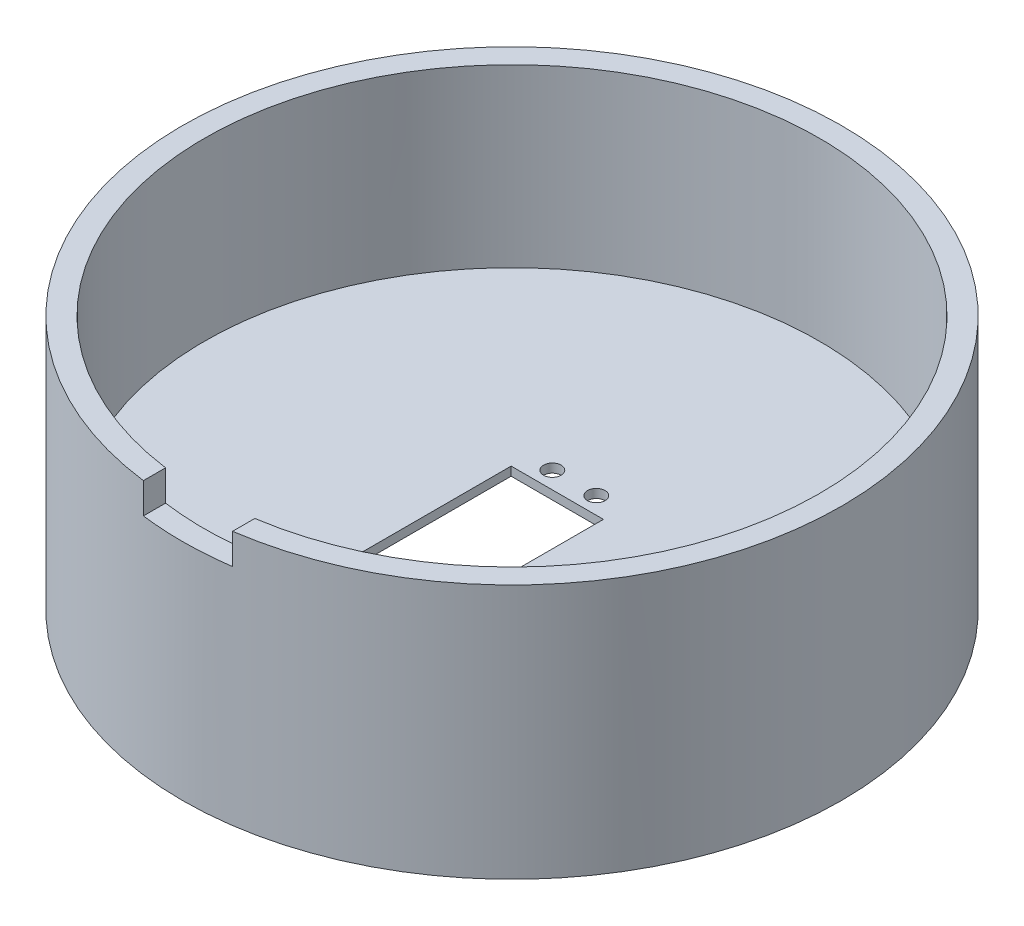
from build123d import *

# Parameters (mm, degrees)
ESQUISSE1_R             = 75
ESQUISSE1_R_2           = 2
ESQUISSE1_W             = 21
ESQUISSE1_H             = 41
BOSS_EXTRU_1_DEPTH      = 2
BOSS_EXTRU_2_START      = 40
ESQUISSE1_4_R           = 75
ESQUISSE1_4_R_2         = 70
BOSS_EXTRU_2_DEPTH      = 40
ESQUISSE2_W             = 20.133446777
ESQUISSE2_H             = 7.336961674
ENL_V_MAT_EXTRU_1_DEPTH = 40
ESQUISSE1_5_R           = 75
ESQUISSE1_5_R_2         = 70
BOSS_EXTRU_3_DEPTH      = 18


with BuildPart() as part:
    # Esquisse1 → Boss.-Extru.1 (new body)
    with BuildSketch(Plane(origin=(0, 0, 0), x_dir=(1, 0, 0), z_dir=(0, 1, 0))):
        Circle(ESQUISSE1_R)
        with Locations((5, 14.17927264)):
            Circle(ESQUISSE1_R_2, mode=Mode.SUBTRACT)
        with Locations((-5, -34.45072736)):
            Circle(ESQUISSE1_R_2, mode=Mode.SUBTRACT)
        with Locations((5, -34.45072736)):
            Circle(ESQUISSE1_R_2, mode=Mode.SUBTRACT)
        with Locations((0, -10.2)):
            Rectangle(ESQUISSE1_W, ESQUISSE1_H, mode=Mode.SUBTRACT)
        with Locations((-5, 14.17927264)):
            Circle(ESQUISSE1_R_2, mode=Mode.SUBTRACT)
    extrude(amount=-BOSS_EXTRU_1_DEPTH)

    # Esquisse1<4> → Boss.-Extru.2 (add)
    with BuildSketch(Plane(origin=(0, 0, 0), x_dir=(1, 0, 0), z_dir=(0, 1, 0)).offset(BOSS_EXTRU_2_START)):
        Circle(ESQUISSE1_4_R)
        Circle(ESQUISSE1_4_R_2, mode=Mode.SUBTRACT)
    extrude(amount=-BOSS_EXTRU_2_DEPTH)

    # Esquisse2 → Enlèv. mat.-Extru.1 (cut)
    with BuildSketch(Plane.XY.offset(75)):
        with Locations((0.592594447, 36.707948234)):
            Rectangle(ESQUISSE2_W, ESQUISSE2_H)
    extrude(amount=-ENL_V_MAT_EXTRU_1_DEPTH, mode=Mode.SUBTRACT)

    # Esquisse1<5> → Boss.-Extru.3 (add)
    with BuildSketch(Plane(origin=(0, 0, 0), x_dir=(1, 0, 0), z_dir=(0, 1, 0))):
        Circle(ESQUISSE1_5_R)
        Circle(ESQUISSE1_5_R_2, mode=Mode.SUBTRACT)
    extrude(amount=-BOSS_EXTRU_3_DEPTH)


solid = part.part
